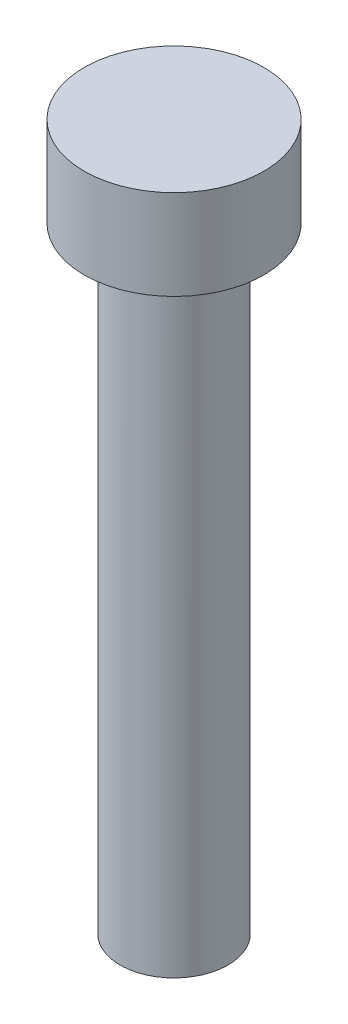
from build123d import *

# Parameters (mm, degrees)
SKETCH2_R           = 3.048
BOSS_EXTRUDE1_DEPTH = 29.718
SKETCH3_R           = 5.08
BOSS_EXTRUDE2_DEPTH = 5.08
BOSS_EXTRUDE3_START = 5.08
SKETCH4_R           = 3.048
BOSS_EXTRUDE3_DEPTH = 5.08


with BuildPart() as part:
    # Sketch2 → Boss-Extrude1 (new body)
    with BuildSketch(Plane(origin=(0, 0, 0), x_dir=(1, 0, 0), z_dir=(0, 1, 0))):
        with Locations(Location((0, 0, 0), (0, 0, 270))):
            Circle(SKETCH2_R)
    extrude(amount=BOSS_EXTRUDE1_DEPTH)

    # Sketch3 → Boss-Extrude2 (add)
    with BuildSketch(Plane(origin=(0, 29.718, 0), x_dir=(1, 0, 0), z_dir=(0, 1, 0))):
        with Locations(Location((0, 0, 0), (0, 0, 270))):
            Circle(SKETCH3_R)
    extrude(amount=BOSS_EXTRUDE2_DEPTH)

    # Sketch4 → Boss-Extrude3 (add)
    with BuildSketch(Plane.XZ.offset(BOSS_EXTRUDE3_START)):
        with Locations(Location((0, 0, 0), (0, 0, 270))):
            Circle(SKETCH4_R)
    extrude(amount=-BOSS_EXTRUDE3_DEPTH)


solid = part.part
